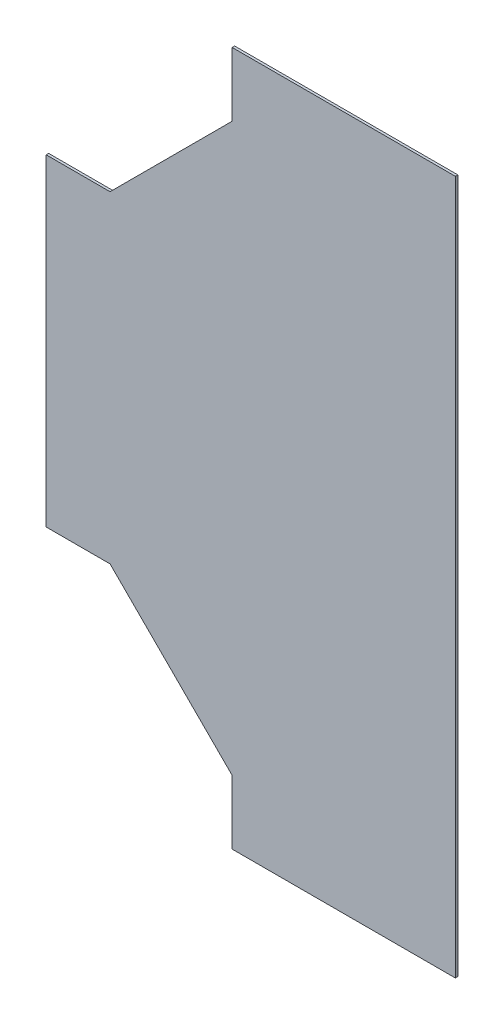
from build123d import *

# Parameters (mm, degrees)
SKETCH1_W           = 711.2
SKETCH1_H           = 419.1
BOSS_EXTRUDE1_DEPTH = 2.54
CUT_EXTRUDE1_DEPTH  = 413.757815311


with BuildPart() as part:
    # Sketch1 → Boss-Extrude1 (new body)
    with BuildSketch(Plane(origin=(0, 0, 0), x_dir=(0, 1, 0), z_dir=(0, 0, 1))):
        Rectangle(SKETCH1_W, SKETCH1_H)
    extrude(amount=BOSS_EXTRUDE1_DEPTH)

    # Sketch2 → Cut-Extrude1 (cut, through all)
    with BuildSketch(Plane.XY.offset(2.54)):
        Polygon((-144.11270055, 165.1), (-19.05, 290.16270055), (-19.05, 355.6), (-209.55, 355.6), (-209.55, 165.1), align=None)
        Polygon((-19.05, -355.6), (-209.55, -355.6), (-209.55, -165.1), (-144.11270055, -165.1), (-19.05, -290.16270055), align=None)
    extrude(amount=-CUT_EXTRUDE1_DEPTH, mode=Mode.SUBTRACT)


solid = part.part
